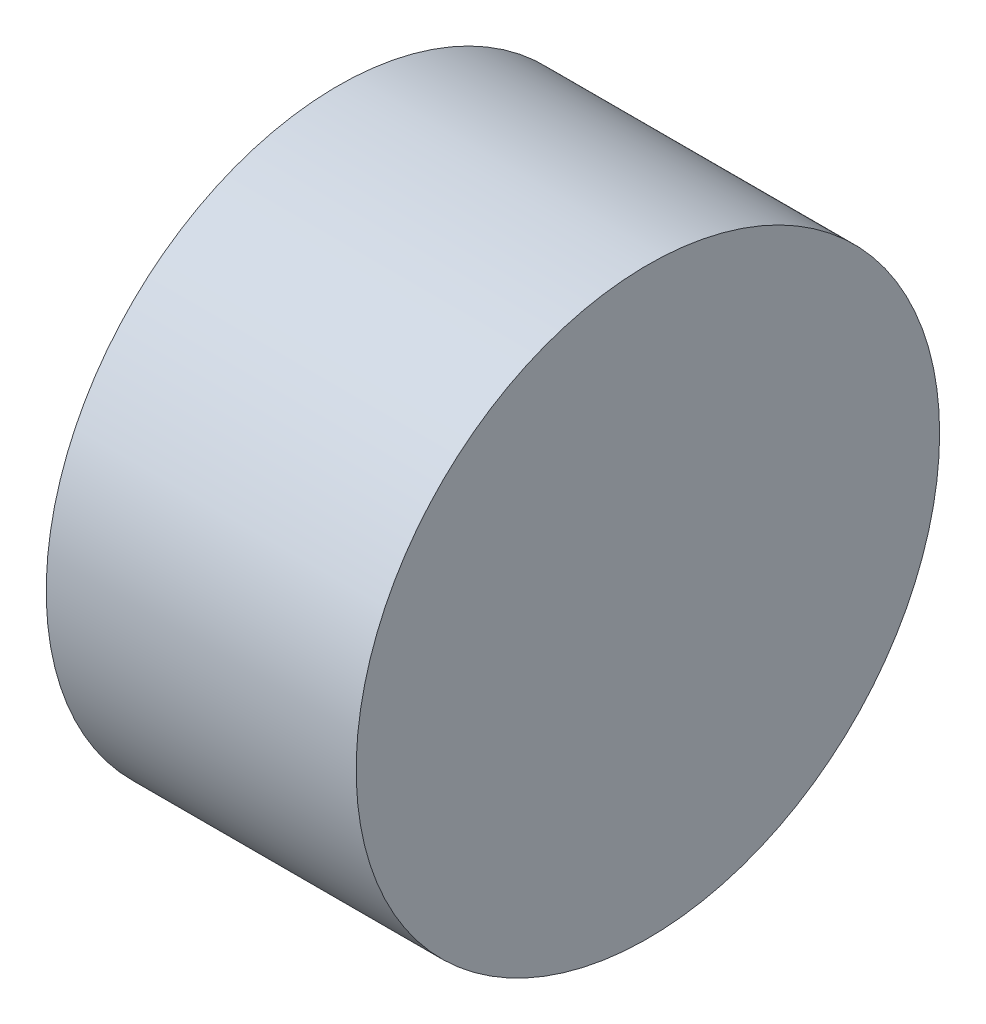
from build123d import *


with BuildPart() as part:
    # Esboço1 → Revolução1 (revolve)
    with BuildSketch(Plane.XY, mode=Mode.PRIVATE) as revolu_o1_sk:
        Polygon((0, 0), (0, 16), (-17, 16), (-17, 11), (-3, 11), (-3, 5), (-12, 5), (-12, 2), (-3, 2), (-3, 0), align=None)
    revolve(revolu_o1_sk.sketch.rotate(Axis((0, 0, 0), (-1, 0, 0)), 90), axis=Axis((0, 0, 0), (-1, 0, 0)))


solid = part.part
